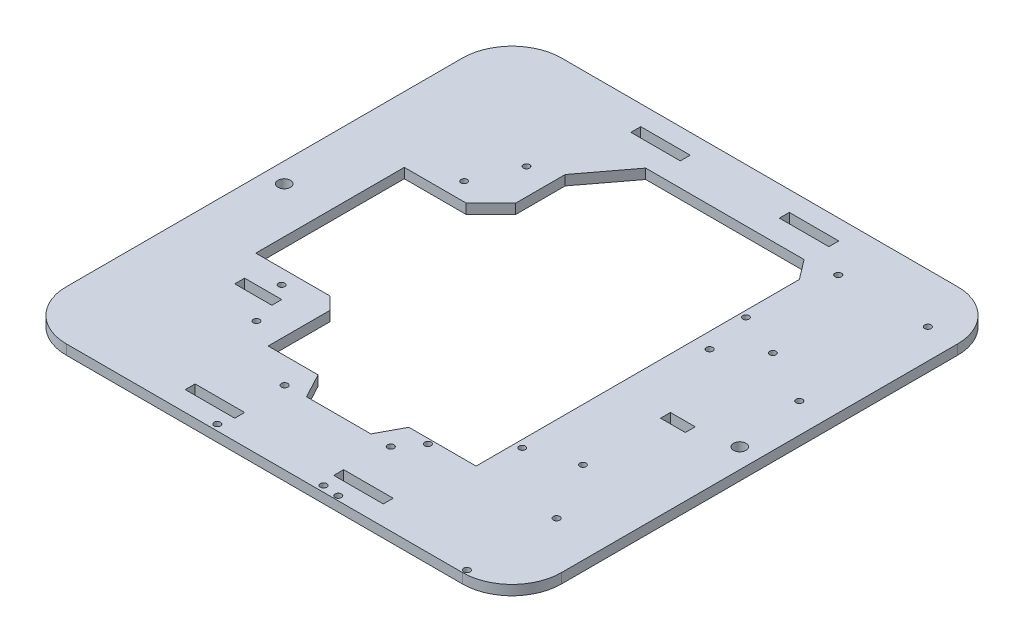
from build123d import *

# Parameters (mm, degrees)
SKETCH1_W               = 254
SKETCH1_H               = 254
PLATFORM_BASE_DEPTH     = 5.08
SKETCH5_W               = 97.79
SKETCH5_H               = 152.4
CUT_EXTRUDE3_DEPTH      = 180.676950108
SKETCH6_W               = 25.4
SKETCH6_H               = 5.08
CUT_EXTRUDE4_DEPTH      = 180.676950108
CORNER_ROUNDING_R       = 25.4
MIRROR6_COPY_1_SKETCH_W = 25.4
MIRROR6_COPY_1_SKETCH_H = 5.08
MIRROR6_COPY_1_DEPTH    = 180.676950108
MIRROR6_COPY_2_SKETCH_W = 25.4
MIRROR6_COPY_2_SKETCH_H = 5.08
MIRROR6_COPY_2_DEPTH    = 180.676950108
SKETCH7_R               = 3.175
CUT_EXTRUDE5_DEPTH      = 180.676950108
SKETCH11_W              = 12.7
SKETCH11_H              = 5.08
CUT_EXTRUDE8_DEPTH      = 180.676950108
SKETCH12_W              = 19.05
SKETCH12_H              = 5.08
CUT_EXTRUDE10_DEPTH     = 16.51
SKETCH14_W              = 152.4
SKETCH14_H              = 8.030698274
CUT_EXTRUDE12_DEPTH     = 19.05
SKETCH16_W              = 76.2
SKETCH16_H              = 5.08
CUT_EXTRUDE14_DEPTH     = 44.45
CUT_EXTRUDE16_DEPTH     = 180.676950108
CUT_EXTRUDE18_DEPTH     = 180.676950108
CUT_EXTRUDE19_DEPTH     = 180.676950108
CUT_EXTRUDE20_DEPTH     = 180.676950108
SKETCH27_W              = 10.16
SKETCH27_H              = 5.08
BOSS_EXTRUDE1_DEPTH     = 177.8
SKETCH28_R              = 1.6
CUT_EXTRUDE22_DEPTH     = 180.676950108
SKETCH29_R              = 1.651
CUT_EXTRUDE23_DEPTH     = 180.676950108
SKETCH30_R              = 1.651
CUT_EXTRUDE24_DEPTH     = 180.676950108
SKETCH32_R              = 1.651
CUT_EXTRUDE26_DEPTH     = 180.676950108


with BuildPart() as part:
    # Sketch1 → Platform-Base (new body)
    with BuildSketch(Plane(origin=(0, 0, 0), x_dir=(1, 0, 0), z_dir=(0, 1, 0))):
        Rectangle(SKETCH1_W, SKETCH1_H)
    extrude(amount=PLATFORM_BASE_DEPTH)

    # Sketch5 → Cut-Extrude3 (cut, through all)
    with BuildSketch(Plane(origin=(0, 5.08, 0), x_dir=(1, 0, 0), z_dir=(0, 1, 0))):
        Rectangle(SKETCH5_W, SKETCH5_H)
    extrude(amount=-CUT_EXTRUDE3_DEPTH, mode=Mode.SUBTRACT)

    # Sketch6 → Cut-Extrude4 (cut, through all)
    with BuildSketch(Plane(origin=(0, 5.08, 0), x_dir=(1, 0, 0), z_dir=(0, 1, 0))):
        with Locations((38.1, -114.3)):
            Rectangle(SKETCH6_W, SKETCH6_H)
    cut_extrude4 = extrude(amount=-CUT_EXTRUDE4_DEPTH, mode=Mode.SUBTRACT)

    # Mirror4: Cut-Extrude4 across plane
    add(cut_extrude4.mirror(Plane.XY), mode=Mode.SUBTRACT)

    # Corner-Rounding
    corner_rounding_edges = [part.edges().sort_by_distance(p)[0] for p in [
        (-127, 2.54, -127),
        (127, 2.54, -127),
        (127, 2.54, 127),
        (-127, 2.54, 127),
    ]]
    fillet(corner_rounding_edges, radius=CORNER_ROUNDING_R)

    # Mirror6 copy 1 sketch → Mirror6 copy 1 (cut, through all)
    with BuildSketch(Plane(origin=(0, 5.08, 0), x_dir=(-1, 0, 0), z_dir=(0, 1, 0))):
        with Locations((38.1, -114.3)):
            Rectangle(MIRROR6_COPY_1_SKETCH_W, MIRROR6_COPY_1_SKETCH_H)
    extrude(amount=-MIRROR6_COPY_1_DEPTH, mode=Mode.SUBTRACT)

    # Mirror6 copy 2 sketch → Mirror6 copy 2 (cut, through all)
    with BuildSketch(Plane(origin=(0, 5.08, 0), x_dir=(-1, 0, 0), z_dir=(0, 1, 0))):
        with Locations((38.1, 114.3)):
            Rectangle(MIRROR6_COPY_2_SKETCH_W, MIRROR6_COPY_2_SKETCH_H)
    extrude(amount=-MIRROR6_COPY_2_DEPTH, mode=Mode.SUBTRACT)

    # Sketch7 → Cut-Extrude5 (cut, through all)
    with BuildSketch(Plane(origin=(0, 5.08, 0), x_dir=(1, 0, 0), z_dir=(0, 1, 0))):
        with Locations((116.84, 0)):
            Circle(SKETCH7_R)
    cut_extrude5 = extrude(amount=-CUT_EXTRUDE5_DEPTH, mode=Mode.SUBTRACT)

    # Mirror7: Cut-Extrude5 across plane
    add(cut_extrude5.mirror(Plane.ZY), mode=Mode.SUBTRACT)

    # Sketch11 → Cut-Extrude8 (cut, through all)
    with BuildSketch(Plane(origin=(0, 5.08, 0), x_dir=(1, 0, 0), z_dir=(0, 1, 0))):
        with Locations((90.17, -5.08)):
            Rectangle(SKETCH11_W, SKETCH11_H)
    extrude(amount=-CUT_EXTRUDE8_DEPTH, mode=Mode.SUBTRACT)

    # Sketch12 → Cut-Extrude10 (cut)
    with BuildSketch(Plane(origin=(0, 5.08, 0), x_dir=(1, 0, 0), z_dir=(0, 1, 0))):
        with Locations((-75.565, -54.61)):
            Rectangle(SKETCH12_W, SKETCH12_H)
    extrude(amount=-CUT_EXTRUDE10_DEPTH, mode=Mode.SUBTRACT)

    # Sketch14 → Cut-Extrude12 (cut)
    with BuildSketch(Plane.ZY.offset(-48.895)):
        with Locations((0, 3.604650863)):
            Rectangle(SKETCH14_W, SKETCH14_H)
    extrude(amount=-CUT_EXTRUDE12_DEPTH, mode=Mode.SUBTRACT)

    # Sketch16 → Cut-Extrude14 (cut)
    with BuildSketch(Plane(origin=(-48.895, 0, 0), x_dir=(0, 0, -1), z_dir=(1, 0, 0))):
        with Locations((0, 2.54)):
            Rectangle(SKETCH16_W, SKETCH16_H)
    extrude(amount=-CUT_EXTRUDE14_DEPTH, mode=Mode.SUBTRACT)

    # Sketch18 → Cut-Extrude16 (cut, through all)
    with BuildSketch(Plane(origin=(0, 5.08, 0), x_dir=(1, 0, 0), z_dir=(0, 1, 0))):
        Polygon((-48.895, 76.2), (-26.616832453, 34.380865163), (67.945, 76.2), (50.165, 99.686546388), (-31.115, 99.686546388), align=None)
    extrude(amount=-CUT_EXTRUDE16_DEPTH, mode=Mode.SUBTRACT)

    # Sketch20 → Cut-Extrude18 (cut, through all)
    with BuildSketch(Plane(origin=(0, 5.08, 0), x_dir=(1, 0, 0), z_dir=(0, 1, 0))):
        Polygon((-48.895, 38.1), (-48.895, 50.8), (-61.595, 38.1), align=None)
    extrude(amount=-CUT_EXTRUDE18_DEPTH, mode=Mode.SUBTRACT)

    # Sketch21 → Cut-Extrude19 (cut, through all)
    with BuildSketch(Plane(origin=(0, 5.08, 0), x_dir=(1, 0, 0), z_dir=(0, 1, 0))):
        Polygon((-48.895, -38.1), (-48.895, -44.45), (-55.245, -38.1), align=None)
    extrude(amount=-CUT_EXTRUDE19_DEPTH, mode=Mode.SUBTRACT)

    # Sketch22 → Cut-Extrude20 (cut, through all)
    with BuildSketch(Plane(origin=(0, 5.08, 0), x_dir=(1, 0, 0), z_dir=(0, 1, 0))):
        Polygon((0, -88.9), (16.51, -88.9), (23.293914706, -76.2), (-5.638297494, -47.784601192), (-23.293914706, -76.2), (-16.51, -88.9), align=None)
    extrude(amount=-CUT_EXTRUDE20_DEPTH, mode=Mode.SUBTRACT)

    # Sketch27 → Boss-Extrude1 (add)
    with BuildSketch(Plane(origin=(0, 0, 76.2), x_dir=(-1, 0, 0), z_dir=(0, 0, -1))):
        with Locations((-62.865, 2.54)):
            Rectangle(SKETCH27_W, SKETCH27_H)
    extrude(amount=BOSS_EXTRUDE1_DEPTH)

    # Sketch28 → Cut-Extrude22 (cut, through all)
    with BuildSketch(Plane.XZ):
        with Locations((-62.993507929, 68.100453228)):
            Circle(SKETCH28_R)
        with Locations((-72.599277809, 45.591362065)):
            Circle(SKETCH28_R)
        with Locations((-71.85594825, -47.293928362)):
            Circle(SKETCH28_R)
        with Locations((-62.446970512, -69.88598754)):
            Circle(SKETCH28_R)
        with Locations((60.907666067, -59.104099387)):
            Circle(SKETCH28_R)
        with Locations((83.684609303, -50.151956805)):
            Circle(SKETCH28_R)
        with Locations((84.63204517, 48.251627594)):
            Circle(SKETCH28_R)
        with Locations((61.507720386, 56.263843475)):
            Circle(SKETCH28_R)
    extrude(amount=-CUT_EXTRUDE22_DEPTH, mode=Mode.SUBTRACT)

    # Sketch29 → Cut-Extrude23 (cut, through all)
    with BuildSketch(Plane(origin=(0, 5.08, 0), x_dir=(1, 0, 0), z_dir=(0, 1, 0))):
        with Locations((-27.25, -123.93)):
            Circle(SKETCH29_R)
        with Locations((-27.25, -89.43)):
            Circle(SKETCH29_R)
        with Locations((27.25, -89.43)):
            Circle(SKETCH29_R)
        with Locations((27.25, -123.93)):
            Circle(SKETCH29_R)
    extrude(amount=-CUT_EXTRUDE23_DEPTH, mode=Mode.SUBTRACT)

    # Sketch30 → Cut-Extrude24 (cut, through all)
    with BuildSketch(Plane(origin=(0, 5.08, 0), x_dir=(1, 0, 0), z_dir=(0, 1, 0))):
        with Locations((101.6, -124.74)):
            Circle(SKETCH30_R)
        with Locations((35.6, -124.74)):
            Circle(SKETCH30_R)
        with Locations((35.6, -78.74)):
            Circle(SKETCH30_R)
        with Locations((101.6, -78.74)):
            Circle(SKETCH30_R)
    extrude(amount=-CUT_EXTRUDE24_DEPTH, mode=Mode.SUBTRACT)

    # Sketch32 → Cut-Extrude26 (cut, through all)
    with BuildSketch(Plane(origin=(0, 5.08, 0), x_dir=(1, 0, 0), z_dir=(0, 1, 0))):
        with Locations((65.76, 35.6)):
            Circle(SKETCH32_R)
        with Locations((111.76, 35.6)):
            Circle(SKETCH32_R)
        with Locations((111.76, 101.6)):
            Circle(SKETCH32_R)
        with Locations((65.76, 101.6)):
            Circle(SKETCH32_R)
    extrude(amount=-CUT_EXTRUDE26_DEPTH, mode=Mode.SUBTRACT)


solid = part.part
